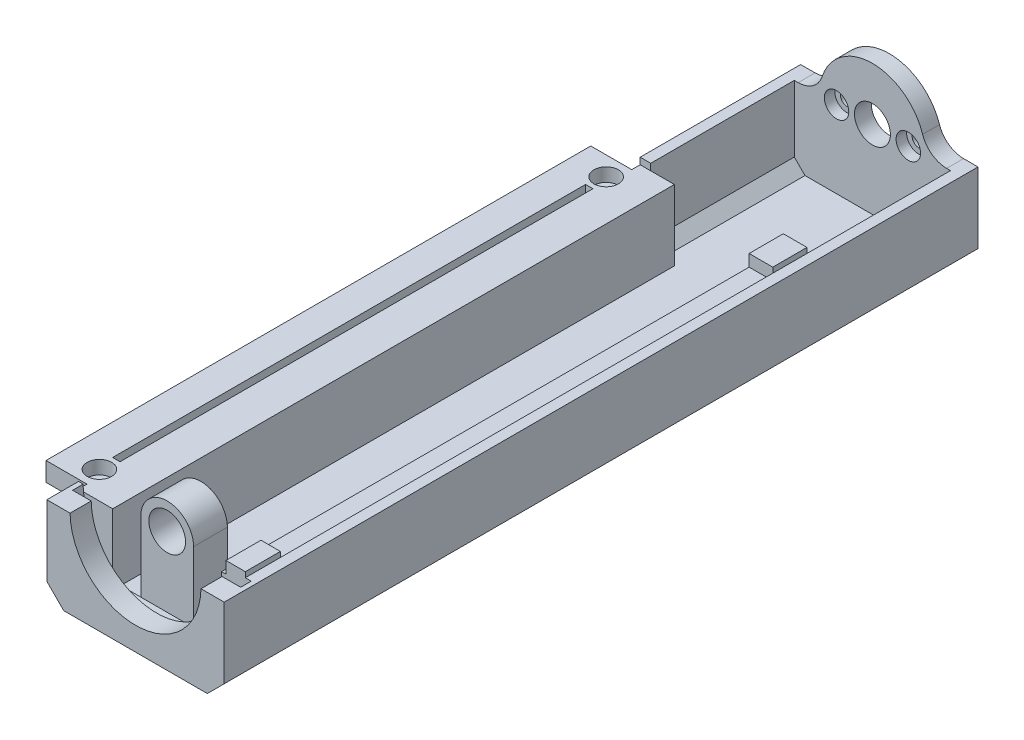
from build123d import *

# Parameters (mm, degrees)
BOSS_EXTRUDE1_DEPTH = 178.5
CUT_EXTRUDE3_DEPTH  = 169.5
CUT_EXTRUDE2_REACH  = 182.954
SKETCH3_R           = 15.5
CUT_EXTRUDE4_DEPTH  = 2.5
BOSS_EXTRUDE3_DEPTH = 8
BOSS_EXTRUDE4_DEPTH = 133
SKETCH11_R          = 4.35
CUT_EXTRUDE6_DEPTH  = 10
SKETCH12_W          = 6.838099821
SKETCH12_H          = 1.8
CUT_EXTRUDE7_DEPTH  = 133
SKETCH13_W          = 17.8
SKETCH13_H          = 129
BOSS_EXTRUDE5_DEPTH = 4.5
SKETCH16_W          = 16.3
SKETCH16_H          = 129
CUT_EXTRUDE8_DEPTH  = 182.71634489
SKETCH17_R          = 1.6
SKETCH17_W          = 1.75
SKETCH17_H          = 112
CUT_EXTRUDE10_DEPTH = 182.71634489
SKETCH18_R          = 2.9
CUT_EXTRUDE11_DEPTH = 3.2
SKETCH19_R          = 12.5
BOSS_EXTRUDE6_DEPTH = 4
SKETCH20_R          = 4.25
SKETCH20_R_2        = 1.6
CUT_EXTRUDE12_DEPTH = 4
SKETCH21_R          = 2.9
CUT_EXTRUDE13_DEPTH = 2.5
FILLET1_R           = 6
SKETCH22_W          = 5.6
SKETCH22_H          = 8.1
SKETCH22_W_2        = 4.6
SKETCH22_H_2        = 8.3
BOSS_EXTRUDE7_DEPTH = 2.8
BOSS_EXTRUDE8_DEPTH = 2.5


with BuildPart() as part:
    # Sketch1 → Boss-Extrude1 (new body)
    with BuildSketch(Plane.XY):
        Polygon((-21, -0.25), (21, -0.25), (21, -17), (17, -21), (-17, -21), (-21, -17), align=None)
    extrude(amount=BOSS_EXTRUDE1_DEPTH)

    # Sketch4 → Cut-Extrude3 (cut)
    with BuildSketch(Plane.XY.offset(173.5)):
        Polygon((-18.5, -15.964466094), (-15.964466094, -18.5), (15.964466094, -18.5), (18.5, -15.964466094), (18.5, -2.75), (18.5, -0.25), (-18.5, -0.25), (-18.5, -2.75), align=None)
    extrude(amount=-CUT_EXTRUDE3_DEPTH, mode=Mode.SUBTRACT)

    # Sketch3 → Cut-Extrude2 (cut, up to next)
    with BuildSketch(Plane.XY.offset(178.5), mode=Mode.PRIVATE) as cut_extrude2_sk1:
        Circle(SKETCH3_R)
    cut_extrude2_tool1 = extrude(cut_extrude2_sk1.sketch, amount=-CUT_EXTRUDE2_REACH, mode=Mode.PRIVATE) & part.part
    add(cut_extrude2_tool1.solids().sort_by_distance((0, 0, 178.5))[0], mode=Mode.SUBTRACT)

    # Sketch6 → Cut-Extrude4 (cut)
    with BuildSketch(Plane.XY.offset(173.5)):
        with BuildLine():
            Line((-10.974971526, 16.6), (10.974971526, 16.6))
            ThreePointArc((10.974971526, 16.6), (19.9, 0), (10.974971526, -16.6))
            Line((10.974971526, -16.6), (-10.974971526, -16.6))
            ThreePointArc((-10.974971526, -16.6), (-19.9, 0), (-10.974971526, 16.6))
        make_face()
    extrude(amount=-CUT_EXTRUDE4_DEPTH, mode=Mode.SUBTRACT)

    # Sketch7 → Boss-Extrude3 (add)
    with BuildSketch(Plane.XY.offset(171)):
        with BuildLine():
            Line((-6.25, 0), (-6.25, -21))
            Line((-6.25, -21), (6.25, -21))
            Line((6.25, -21), (6.25, 0))
            ThreePointArc((6.25, 0), (0, 6.25), (-6.25, 0))
        make_face()
    extrude(amount=-BOSS_EXTRUDE3_DEPTH)

    # Sketch10 → Boss-Extrude4 (add)
    with BuildSketch(Plane.XY.offset(171)):
        Polygon((-18.5, -1.8), (-18.5, -15.964466094), (-15.964466094, -18.5), (-12.9, -18.5), (-12.9, -1.8), align=None)
    boss_extrude4 = extrude(amount=-BOSS_EXTRUDE4_DEPTH)

    # Mirror1: Boss-Extrude4 across plane
    add(boss_extrude4.mirror(Plane(origin=(0, 0, 0), x_dir=(0, 0, 1), z_dir=(1, 0, 0))))

    # Sketch11 → Cut-Extrude6 (cut)
    with BuildSketch(Plane.XY.offset(171)):
        Circle(SKETCH11_R)
    extrude(amount=-CUT_EXTRUDE6_DEPTH, mode=Mode.SUBTRACT)

    # Sketch12 → Cut-Extrude7 (cut)
    with BuildSketch(Plane(origin=(0, 0, 38), x_dir=(-1, 0, 0), z_dir=(0, 0, -1))):
        with Locations((21.919049911, -0.9)):
            Rectangle(SKETCH12_W, SKETCH12_H)
    extrude(amount=-CUT_EXTRUDE7_DEPTH, mode=Mode.SUBTRACT)

    # Sketch13 → Boss-Extrude5 (add)
    with BuildSketch(Plane(origin=(0, -1.8, 0), x_dir=(1, 0, 0), z_dir=(0, 1, 0))):
        with Locations((-21.8, -104.5)):
            Rectangle(SKETCH13_W, SKETCH13_H)
    extrude(amount=-BOSS_EXTRUDE5_DEPTH)

    # Sketch16 → Cut-Extrude8 (cut, through all)
    with BuildSketch(Plane.XZ.offset(6.3)):
        with Locations((-22.55, 104.5)):
            Rectangle(SKETCH16_W, SKETCH16_H)
    extrude(amount=CUT_EXTRUDE8_DEPTH, mode=Mode.SUBTRACT)

    # Sketch17 → Cut-Extrude10 (cut, through all)
    with BuildSketch(Plane.XZ.offset(6.3)):
        with Locations(Location((-22.55, 164.5, 0), (0, 0, 270))):
            Circle(SKETCH17_R)
        with Locations(Location((-22.55, 44.5, 0), (0, 0, 270))):
            Circle(SKETCH17_R)
        with Locations((-22.55, 104.5)):
            Rectangle(SKETCH17_W, SKETCH17_H)
    extrude(amount=-CUT_EXTRUDE10_DEPTH, mode=Mode.SUBTRACT)

    # Sketch18 → Cut-Extrude11 (cut)
    with BuildSketch(Plane(origin=(0, -1.8, 0), x_dir=(1, 0, 0), z_dir=(0, 1, 0))):
        with Locations(Location((-22.55, -164.5, 0), (0, 0, 270))):
            Circle(SKETCH18_R)
        with Locations(Location((-22.55, -44.5, 0), (0, 0, 270))):
            Circle(SKETCH18_R)
    extrude(amount=-CUT_EXTRUDE11_DEPTH, mode=Mode.SUBTRACT)

    # Sketch19 → Boss-Extrude6 (add)
    with BuildSketch(Plane.XY):
        Circle(SKETCH19_R)
    extrude(amount=BOSS_EXTRUDE6_DEPTH)

    # Sketch20 → Cut-Extrude12 (cut)
    with BuildSketch(Plane.XY):
        Circle(SKETCH20_R)
        with Locations((-8.5, -0.25)):
            Circle(SKETCH20_R_2)
        with Locations(Location((8.5, -0.25, 0), (0, 0, 180))):
            Circle(SKETCH20_R_2)
    extrude(amount=CUT_EXTRUDE12_DEPTH, mode=Mode.SUBTRACT)

    # Sketch21 → Cut-Extrude13 (cut)
    with BuildSketch(Plane.XY.offset(4)):
        with Locations((-8.5, -0.25)):
            Circle(SKETCH21_R)
        with Locations((8.5, -0.25)):
            Circle(SKETCH21_R)
    extrude(amount=-CUT_EXTRUDE13_DEPTH, mode=Mode.SUBTRACT)

    # Fillet1
    fillet1_edges = [part.edges().sort_by_distance(p)[0] for p in [
        (12.49749975, -0.25, 2),
        (-12.49749975, -0.25, 2),
    ]]
    fillet(fillet1_edges, radius=FILLET1_R)

    # Sketch22 → Boss-Extrude7 (add)
    with BuildSketch(Plane(origin=(0, -1.8, 0), x_dir=(1, 0, 0), z_dir=(0, 1, 0))):
        with Locations((15.7, -42.05)):
            Rectangle(SKETCH22_W, SKETCH22_H)
        with Locations((16.2, -166.85)):
            Rectangle(SKETCH22_W_2, SKETCH22_H_2)
    extrude(amount=BOSS_EXTRUDE7_DEPTH)

    # Sketch23 → Boss-Extrude8 (add)
    with BuildSketch(Plane(origin=(0, 0, 173.5), x_dir=(-1, 0, 0), z_dir=(0, 0, -1))):
        with BuildLine():
            Line((-10.974971526, -16.6), (10.974971526, -16.6))
            ThreePointArc((10.974971526, -16.6), (15.448847251, -12.543648537), (18.5, -7.332121112))
            Line((18.5, -7.332121112), (18.5, -15.964466094))
            Line((18.5, -15.964466094), (15.964466094, -18.5))
            Line((15.964466094, -18.5), (-15.964466094, -18.5))
            Line((-15.964466094, -18.5), (-18.5, -15.964466094))
            Line((-18.5, -15.964466094), (-18.5, -7.332121112))
            ThreePointArc((-18.5, -7.332121112), (-15.448847251, -12.543648537), (-10.974971526, -16.6))
        make_face()
    extrude(amount=BOSS_EXTRUDE8_DEPTH)


solid = part.part
